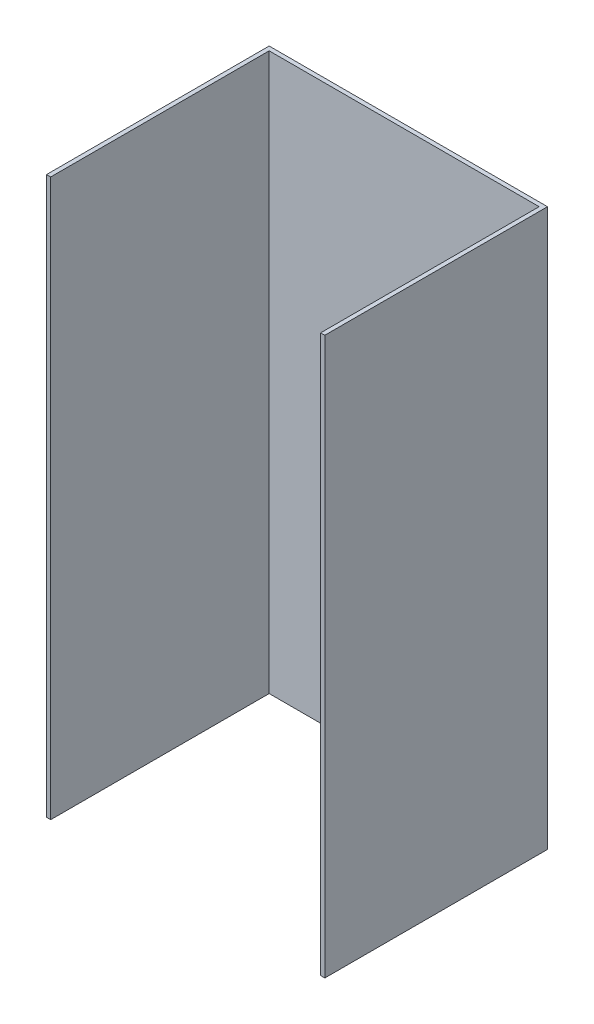
from build123d import *

# Parameters (mm, degrees)
SKETCH1_W           = 100
SKETCH1_H           = 200
BOSS_EXTRUDE1_DEPTH = 80
SHELL1_T            = -1.5


with BuildPart() as part:
    # Sketch1 → Boss-Extrude1 (new body)
    with BuildSketch(Plane.XY):
        Rectangle(SKETCH1_W, SKETCH1_H)
    extrude(amount=BOSS_EXTRUDE1_DEPTH)

    # Shell1
    shell1_openings = [part.faces().sort_by_distance(p)[0] for p in [
        (0, 0, 80),
        (0, 100, 40),
        (0, -100, 40),
    ]]
    offset(amount=SHELL1_T, openings=shell1_openings, kind=Kind.INTERSECTION)


solid = part.part
